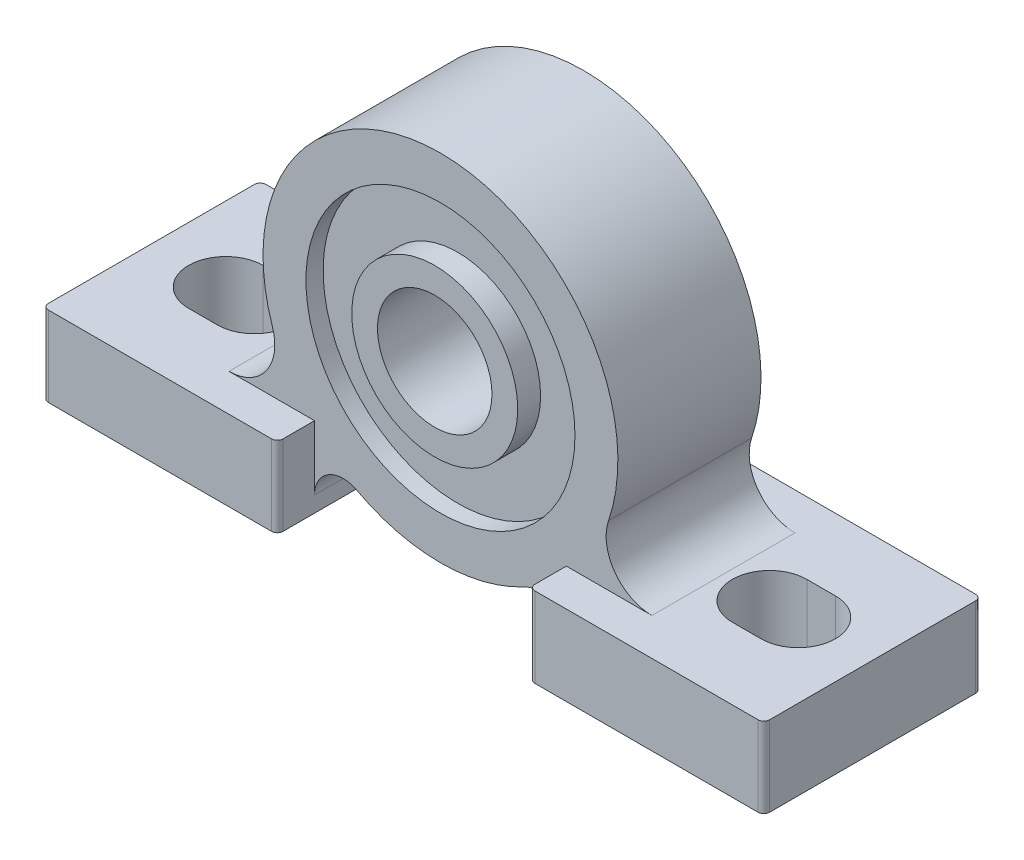
from build123d import *

# Parameters (mm, degrees)
SKETCH_8_R      = 14.5
SKETCH_8_R_2    = 10
EXTRUDE_1_DEPTH = 31
SKETCH_10_R     = 23.5
SKETCH_10_R_2   = 14.5
EXTRUDE_2_DEPTH = 17
EXTRUDE_START   = -5
SKETCH_11_R     = 31
SKETCH_11_R_2   = 23.5
EXTRUDE_3_DEPTH = 25
SKETCH_13_W     = 41
SKETCH_13_H     = 38
EXTRUDE_4_DEPTH = 14
FILLET_1_R      = 8
FILLET_2_R      = 5
FILLET_3_R      = 5
FILLET_4_R      = 8
FILLET_5_R      = 1
FILLET_6_R      = 1


with BuildPart() as part:
    # Эскиз8 → Вытянуть1 (new body)
    with BuildSketch(Plane.XY):
        with Locations((50, -1.5)):
            Circle(SKETCH_8_R)
        with Locations((50, -1.5)):
            Circle(SKETCH_8_R_2, mode=Mode.SUBTRACT)
    extrude(amount=EXTRUDE_1_DEPTH)

    # Эскиз10 → Вытянуть2 (add)
    with BuildSketch(Plane.XY.offset(10)):
        with Locations((50, -1.5)):
            Circle(SKETCH_10_R)
        with Locations((50, -1.5)):
            Circle(SKETCH_10_R_2, mode=Mode.SUBTRACT)
    extrude(amount=EXTRUDE_2_DEPTH)

    # Эскиз11 → Вытянуть3 (add)
    with BuildSketch(Plane.XY.offset(10).offset(EXTRUDE_START)):
        with Locations((50, -1.5)):
            Circle(SKETCH_11_R)
        with Locations((50, -1.5)):
            Circle(SKETCH_11_R_2, mode=Mode.SUBTRACT)
    extrude(amount=EXTRUDE_3_DEPTH)

    # Эскиз13 → Вытянуть4 (add)
    # profile 1 of 2: a face of its own
    with BuildSketch(Plane(origin=(0, -36, 0), x_dir=(-1, 0, 0), z_dir=(0, 1, 0))):
        with Locations((-7.5, 17.5)):
            Rectangle(SKETCH_13_W, SKETCH_13_H)
        with BuildLine():
            Line((-4.740103958, 23.994802079), (0, 24))
            ThreePointArc((0, 24), (6.5, 17.5), (0, 11))
            Line((0, 11), (-5, 11))
            ThreePointArc((-5, 11), (-11.49870039, 17.629974008), (-4.740103958, 23.994802079))
        make_face(mode=Mode.SUBTRACT)
    # profile 2 of 2: a face of its own
    with BuildSketch(Plane(origin=(0, -36, 0), x_dir=(-1, 0, 0), z_dir=(0, 1, 0))):
        with Locations((-92.5, 17.5)):
            Rectangle(SKETCH_13_W, SKETCH_13_H)
        with BuildLine():
            Line((-95, 11), (-100, 11))
            ThreePointArc((-100, 11), (-106.5, 17.5), (-100, 24))
            Line((-100, 24), (-95.259896042, 23.994802079))
            ThreePointArc((-95.259896042, 23.994802079), (-88.50129961, 17.629974008), (-95, 11))
        make_face(mode=Mode.SUBTRACT)
    extrude(amount=EXTRUDE_4_DEPTH)

    # Скругление1
    fillet_1_edges = [part.edges().sort_by_distance(p)[0] for p in [
        (26.745968092, -22, 17.5),
    ]]
    fillet(fillet_1_edges, radius=FILLET_1_R)

    # Скругление2
    fillet_2_edges = [part.edges().sort_by_distance(p)[0] for p in [
        (28, -23.340329668, 17.5),
    ]]
    fillet(fillet_2_edges, radius=FILLET_2_R)

    # Скругление3
    fillet_3_edges = [part.edges().sort_by_distance(p)[0] for p in [
        (72, -23.340329668, 17.5),
    ]]
    fillet(fillet_3_edges, radius=FILLET_3_R)

    # Скругление4
    fillet_4_edges = [part.edges().sort_by_distance(p)[0] for p in [
        (73.254031908, -22, 17.5),
    ]]
    fillet(fillet_4_edges, radius=FILLET_4_R)

    # Скругление5
    fillet_5_edges = [part.edges().sort_by_distance(p)[0] for p in [
        (28, -29, 36.5),
        (28, -29, -1.5),
        (72, -29, -1.5),
        (72, -29, 36.5),
    ]]
    fillet(fillet_5_edges, radius=FILLET_5_R)

    # Скругление6
    fillet_6_edges = [part.edges().sort_by_distance(p)[0] for p in [
        (-13, -29, -1.5),
        (-13, -29, 36.5),
        (113, -29, 36.5),
        (113, -29, -1.5),
    ]]
    fillet(fillet_6_edges, radius=FILLET_6_R)


solid = part.part
